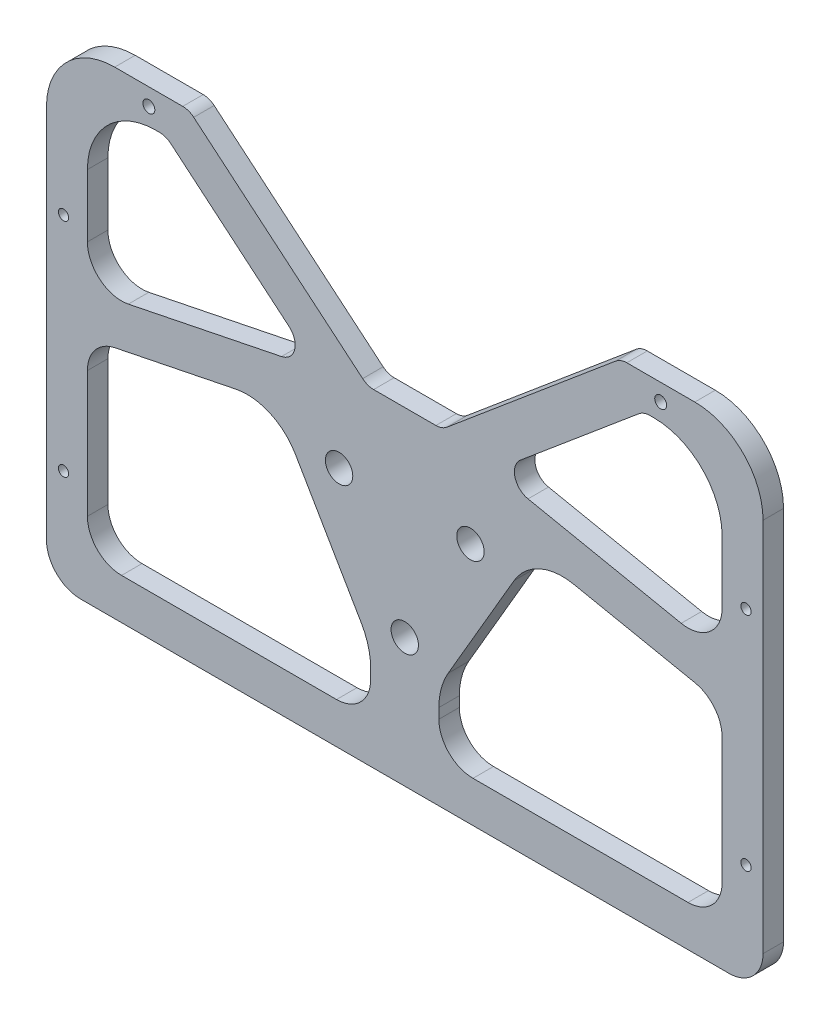
from build123d import *

# Parameters (mm, degrees)
BOSS_EXTRUDE1_DEPTH          = 3
CUT_EXTRUDE1_DEPTH           = 133.140077191
CUT_EXTRUDE1_DEPTH_BACK      = 133.140077191
SKETCH2_R                    = 1.5
O_0_316_DIAMETER_HOLE1_D     = 8.0264
O_0_316_DIAMETER_HOLE1_DEPTH = 10
O_0_316_DIAMETER_HOLE1_TIP   = 2.411373836
SKETCH6_W                    = 140
SKETCH6_H                    = 10
CUT_EXTRUDE2_DEPTH           = 10
SKETCH7_R                    = 1.75
CUT_EXTRUDE3_DEPTH           = 10
BOSS_EXTRUDE3_DEPTH          = 6
FILLET2_R                    = 5


with BuildPart() as part:
    # Sketch1 → Boss-Extrude1 (new, symmetric)
    with BuildSketch(Plane.XY):
        with BuildLine():
            Line((-95, -60), (95, -60))
            ThreePointArc((95, -60), (102.071067812, -57.071067812), (105, -50))
            Line((105, -50), (105, 60))
            ThreePointArc((105, 60), (99.142135624, 74.142135624), (85, 80))
            Line((85, 80), (-85, 80))
            ThreePointArc((-85, 80), (-99.142135624, 74.142135624), (-105, 60))
            Line((-105, 60), (-105, -50))
            ThreePointArc((-105, -50), (-102.071067812, -57.071067812), (-95, -60))
        make_face()
        with BuildLine():
            Line((93, -1.00460734), (93, -38))
            ThreePointArc((93, -38), (90.071067812, -45.071067812), (83, -48))
            Line((83, -48), (20, -48))
            ThreePointArc((20, -48), (12.928932188, -45.071067812), (10, -38))
            Line((10, -38), (10, -35.031250653))
            ThreePointArc((10, -35.031250653), (10.691550782, -29.817443139), (12.71837888, -24.964196891))
            Line((12.71837888, -24.964196891), (32.056244976, 8.232176449))
            ThreePointArc((32.056244976, 8.232176449), (39.499751599, 14.924573129), (49.448622011, 16.026363354))
            Line((49.448622011, 16.026363354), (84.993679344, 8.794639706))
            ThreePointArc((84.993679344, 8.794639706), (90.743926441, 5.322445946), (93, -1.00460734))
        make_face(mode=Mode.SUBTRACT)
        with BuildLine():
            Line((-83, -48), (-20, -48))
            ThreePointArc((-20, -48), (-12.928932188, -45.071067812), (-10, -38))
            Line((-10, -38), (-10, -35.031250653))
            ThreePointArc((-10, -35.031250653), (-10.691550782, -29.817443139), (-12.71837888, -24.964196891))
            Line((-12.71837888, -24.964196891), (-32.056244976, 8.232176449))
            ThreePointArc((-32.056244976, 8.232176449), (-39.499751599, 14.924573129), (-49.448622011, 16.026363354))
            Line((-49.448622011, 16.026363354), (-84.993679344, 8.794639706))
            ThreePointArc((-84.993679344, 8.794639706), (-90.743926441, 5.322445946), (-93, -1.00460734))
            Line((-93, -1.00460734), (-93, -38))
            ThreePointArc((-93, -38), (-90.071067812, -45.071067812), (-83, -48))
        make_face(mode=Mode.SUBTRACT)
        with BuildLine():
            Line((-93, 31.650962878), (-93, 50))
            ThreePointArc((-93, 50), (-87.142135624, 64.142135624), (-73, 70))
            Line((-73, 70), (73, 70))
            ThreePointArc((73, 70), (87.142135624, 64.142135624), (93, 50))
            Line((93, 50), (93, 31.650962878))
            ThreePointArc((93, 31.650962878), (89.327053286, 23.907036437), (81.006320656, 21.851715832))
            Line((81.006320656, 21.851715832), (42.92968902, 29.598494092))
            ThreePointArc((42.92968902, 29.598494092), (40.946091564, 29.899370365), (38.942330332, 30))
            Line((38.942330332, 30), (-38.942330332, 30))
            ThreePointArc((-38.942330332, 30), (-40.946091564, 29.899370365), (-42.92968902, 29.598494092))
            Line((-42.92968902, 29.598494092), (-81.006320656, 21.851715832))
            ThreePointArc((-81.006320656, 21.851715832), (-89.327053286, 23.907036437), (-93, 31.650962878))
        make_face(mode=Mode.SUBTRACT)
    extrude(amount=BOSS_EXTRUDE1_DEPTH, both=True)

    # Sketch2 → Cut-Extrude1 (cut, two sides: drawn at the far end of the back side and taken through both)
    with BuildSketch(Plane.XY.offset(3).offset(-CUT_EXTRUDE1_DEPTH_BACK)):
        with Locations((100, 35)):
            Circle(SKETCH2_R)
        with Locations((100, -30)):
            Circle(SKETCH2_R)
        with Locations(Location((-100, -30, 0), (0, 0, 180))):
            Circle(SKETCH2_R)
        with Locations(Location((-100, 35, 0), (0, 0, 180))):
            Circle(SKETCH2_R)
    extrude(amount=CUT_EXTRUDE1_DEPTH + CUT_EXTRUDE1_DEPTH_BACK, mode=Mode.SUBTRACT)

    # O (0.316) Diameter Hole1
    with Locations(Plane.XY.offset(3)):
        with Locations((-19.247414599, 11.1125), (19.247414599, 11.1125), (0, -22.225)):
            Hole(O_0_316_DIAMETER_HOLE1_D / 2, depth=O_0_316_DIAMETER_HOLE1_DEPTH)
            with Locations((0, 0, -(O_0_316_DIAMETER_HOLE1_DEPTH + O_0_316_DIAMETER_HOLE1_TIP / 2))):  # 118° drill point
                Cone(0, O_0_316_DIAMETER_HOLE1_D / 2, O_0_316_DIAMETER_HOLE1_TIP, mode=Mode.SUBTRACT)

    # Sketch6 → Cut-Extrude2 (cut)
    with BuildSketch(Plane.XY.offset(3)):
        with Locations((0, 75)):
            Rectangle(SKETCH6_W, SKETCH6_H)
    extrude(amount=-CUT_EXTRUDE2_DEPTH, mode=Mode.SUBTRACT)

    # Sketch7 → Cut-Extrude3 (cut)
    with BuildSketch(Plane.XY.offset(3)):
        with Locations((-75, 75)):
            Circle(SKETCH7_R)
        with Locations((75, 75)):
            Circle(SKETCH7_R)
    extrude(amount=-CUT_EXTRUDE3_DEPTH, mode=Mode.SUBTRACT)

    # Sketch8 → Boss-Extrude3 (add)
    with BuildSketch(Plane(origin=(0, 0, -3), x_dir=(-1, 0, 0), z_dir=(0, 0, -1))):
        Polygon((-63.248850004, 80), (-70, 80), (-70, 70), (-25.96476149, 33.050047608), (-42.92968902, 29.598494092), (42.92968902, 29.598494092), (25.96476149, 33.050047608), (70, 70), (70, 80), (69.821528384, 80), (63.248850004, 80), (10.939239008, 36.107024707), (-10.939239008, 36.107024707), align=None)
    extrude(amount=-BOSS_EXTRUDE3_DEPTH)

    # Fillet2
    fillet2_edges = [part.edges().sort_by_distance(p)[0] for p in [
        (70, 70, 0),
        (-70, 70, 0),
        (25.96476149, 33.050047608, 0),
        (63.248850004, 80, 0),
        (10.939239008, 36.107024707, 0),
        (-10.939239008, 36.107024707, 0),
        (-63.248850004, 80, 0),
        (-25.96476149, 33.050047608, 0),
    ]]
    fillet(fillet2_edges, radius=FILLET2_R)


solid = part.part
